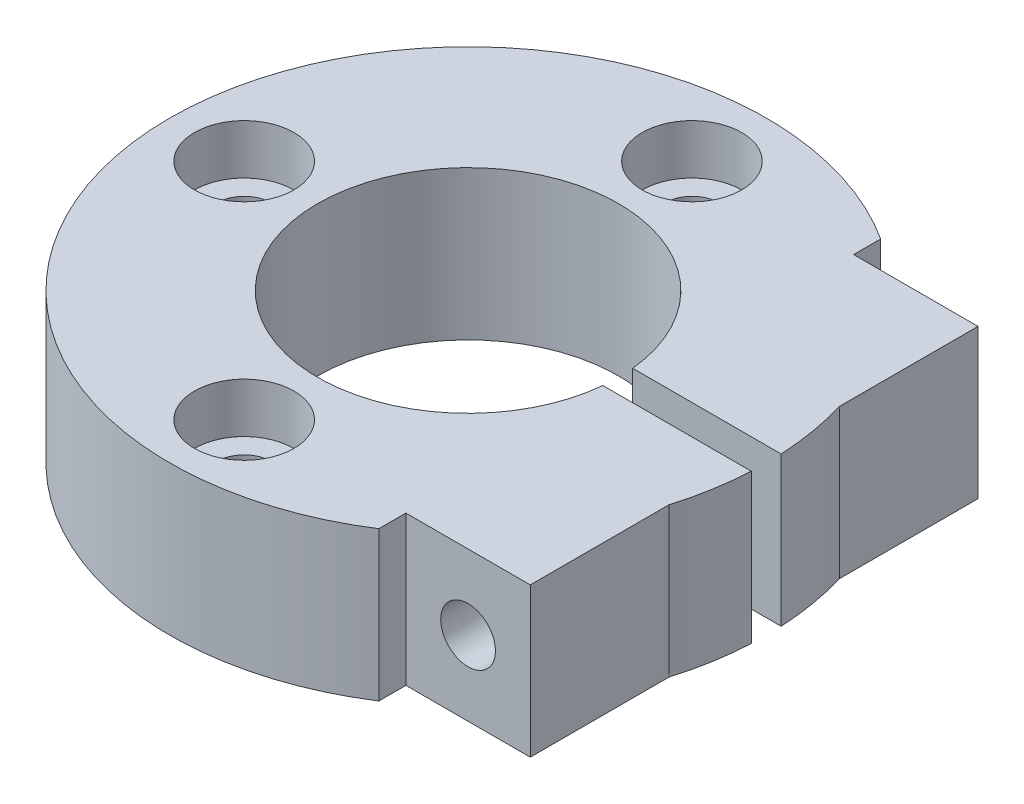
from build123d import *

# Parameters (mm, degrees)
MAIN_PROFILE_SKETCH_R          = 1.1
MAIN_EXTRUSION_DEPTH           = 4
DETAIL_PROFILE_2_SKETCH_R      = 2
DETAIL_EXTRUSION_2_DEPTH       = 2
CROSS_BOLT_CLEARANCE_PROFILE_R = 1.1
CROSS_BOLT_CLEARANCE_DEPTH     = 24


with BuildPart() as part:
    # Main Profile Sketch → Main Extrusion (new body)
    with BuildSketch(Plane(origin=(0, -157, 0), x_dir=(-1, 0, 0), z_dir=(0, -1, 0))):
        with BuildLine():
            Line((44.791651246, -3.4278273), (44.791651246, -9))
            Line((44.791651246, -9), (49.791651246, -9))
            Line((49.791651246, -9), (49.791651246, -10.087120501))
            ThreePointArc((49.791651246, -10.087120501), (68.291651246, 0), (49.791651246, 10.087120501))
            Line((49.791651246, 10.087120501), (49.791651246, 9))
            Line((49.791651246, 9), (44.791651246, 9))
            Line((44.791651246, 9), (44.791651246, 3.4278273))
            ThreePointArc((44.791651246, 3.4278273), (44.46433761, 2.02846054), (44.306660633, 0.6))
            Line((44.306660633, 0.6), (50.27147683, 0.6))
            ThreePointArc((50.27147683, 0.6), (62.341651246, 0), (50.27147683, -0.6))
            Line((50.27147683, -0.6), (44.306660633, -0.6))
            ThreePointArc((44.306660633, -0.6), (44.46433761, -2.02846054), (44.791651246, -3.4278273))
        make_face()
        with Locations(Location((65.291651246, 0, 0), (0, 0, 90))):
            Circle(MAIN_PROFILE_SKETCH_R, mode=Mode.SUBTRACT)
        with Locations(Location((56.291651246, 9, 0), (0, 0, 90))):
            Circle(MAIN_PROFILE_SKETCH_R, mode=Mode.SUBTRACT)
        with Locations(Location((56.291651246, -9, 0), (0, 0, 90))):
            Circle(MAIN_PROFILE_SKETCH_R, mode=Mode.SUBTRACT)
    extrude(amount=MAIN_EXTRUSION_DEPTH)

    # Detail Profile 2 Sketch → Detail Extrusion 2 (add)
    with BuildSketch(Plane(origin=(0, -161, 0), x_dir=(-1, 0, 0), z_dir=(0, -1, 0))):
        with BuildLine():
            Line((44.791651246, -3.4278273), (44.791651246, -9))
            Line((44.791651246, -9), (49.791651246, -9))
            Line((49.791651246, -9), (49.791651246, -10.087120501))
            ThreePointArc((49.791651246, -10.087120501), (68.291651246, 0), (49.791651246, 10.087120501))
            Line((49.791651246, 10.087120501), (49.791651246, 9))
            Line((49.791651246, 9), (44.791651246, 9))
            Line((44.791651246, 9), (44.791651246, 3.4278273))
            ThreePointArc((44.791651246, 3.4278273), (44.46433761, 2.02846054), (44.306660633, 0.6))
            Line((44.306660633, 0.6), (50.27147683, 0.6))
            ThreePointArc((50.27147683, 0.6), (62.341651246, 0), (50.27147683, -0.6))
            Line((50.27147683, -0.6), (44.306660633, -0.6))
            ThreePointArc((44.306660633, -0.6), (44.46433761, -2.02846054), (44.791651246, -3.4278273))
        make_face()
        with Locations(Location((65.291651246, 0, 0), (0, 0, 90))):
            Circle(DETAIL_PROFILE_2_SKETCH_R, mode=Mode.SUBTRACT)
        with Locations(Location((56.291651246, 9, 0), (0, 0, 90))):
            Circle(DETAIL_PROFILE_2_SKETCH_R, mode=Mode.SUBTRACT)
        with Locations(Location((56.291651246, -9, 0), (0, 0, 90))):
            Circle(DETAIL_PROFILE_2_SKETCH_R, mode=Mode.SUBTRACT)
    extrude(amount=DETAIL_EXTRUSION_2_DEPTH)

    # Cross Bolt Clearance profile → Cross Bolt Clearance (cut)
    with BuildSketch(Plane.XY.offset(-12)):
        with Locations(Location((-47.291651246, -160, 0), (0, 0, 180))):
            Circle(CROSS_BOLT_CLEARANCE_PROFILE_R)
    extrude(amount=CROSS_BOLT_CLEARANCE_DEPTH, mode=Mode.SUBTRACT)


with BuildPart() as body_2:
    # Mirror1: mirrored copy
    add(part.part.mirror(Plane(origin=(0, 0, 0), x_dir=(0, 0, 1), z_dir=(0, -1, 0))))


solid = body_2.part
